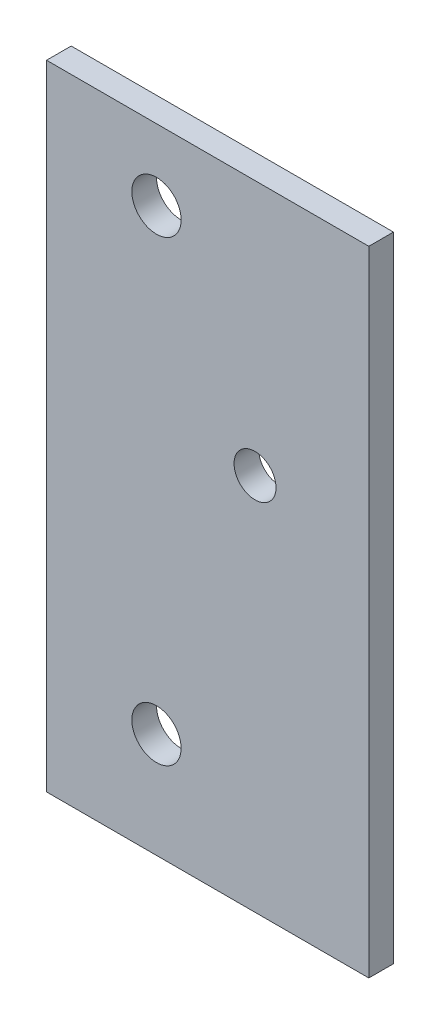
from build123d import *

# Parameters (mm, degrees)
SKETCH1_W               = 41.526561397
SKETCH1_H               = 81.656914339
SKETCH1_R               = 3.175
BOSS_EXTRUDE1_DEPTH     = 3.175
F_1_4_28_TAPPED_HOLE1_D = 5.4102


with BuildPart() as part:
    # Sketch1 → Boss-Extrude1 (new body)
    with BuildSketch(Plane.XY):
        with Locations((-69.601667399, -208.563314709)):
            Rectangle(SKETCH1_W, SKETCH1_H)
        with Locations((-76.2, -176.892857143)):
            Circle(SKETCH1_R, mode=Mode.SUBTRACT)
        with Locations((-76.2, -235.857142857)):
            Circle(SKETCH1_R, mode=Mode.SUBTRACT)
    extrude(amount=BOSS_EXTRUDE1_DEPTH)

    # 1/4-28 Tapped Hole1 (through all)
    with Locations(Plane.XY.offset(3.175)):
        with Locations((-63.5, -200.66)):
            Hole(F_1_4_28_TAPPED_HOLE1_D / 2)


solid = part.part
